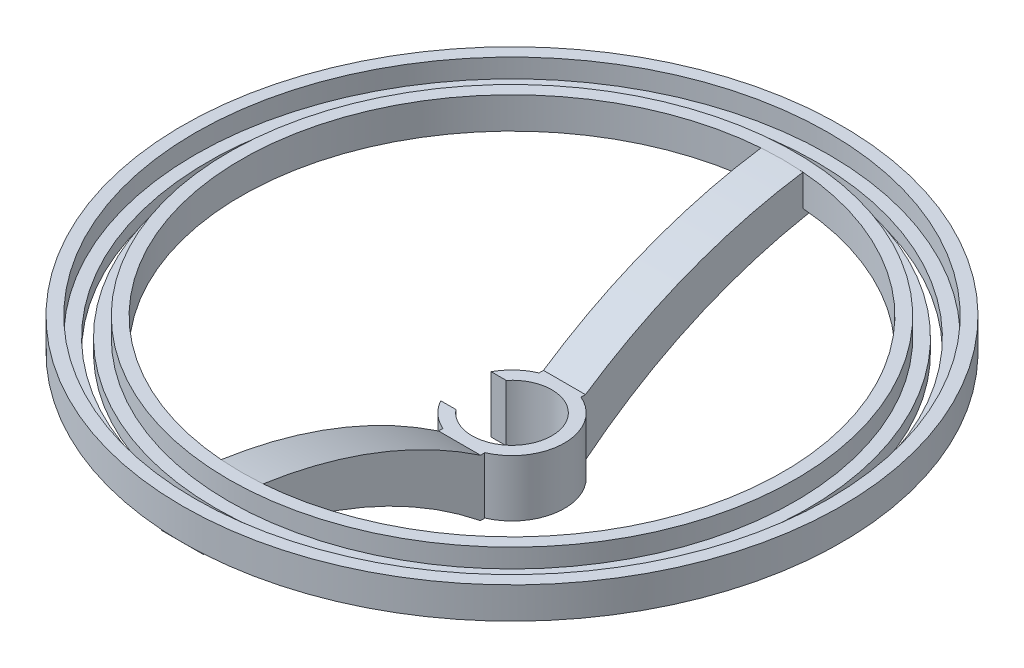
from build123d import *

# Parameters (mm, degrees)
SCHIZZO1_R                   = 12.5
SCHIZZO1_R_2                 = 9.5
ESTRUSIONE_ESTRUSIONE1_DEPTH = 13.5
SCHIZZO2_W                   = 9
SCHIZZO2_H                   = 12
TAGLIO_ESTRUSIONE1_DEPTH     = 23.24297642
ESTRUSIONE_ESTRUSIONE2_DEPTH = 5
SCHIZZO3_R                   = 75.5
SCHIZZO3_R_2                 = 67.5
BOSS_EXTRUDE1_DEPTH          = 3
SKETCH1_W                    = 3
SKETCH1_H                    = 7.5
SKETCH2_R                    = 72.5
SKETCH2_R_2                  = 70.5
CUT_EXTRUDE1_DEPTH           = 3


with BuildPart() as part:
    # Schizzo1 → Estrusione-Estrusione1 (new body)
    with BuildSketch(Plane(origin=(0, 0, 0), x_dir=(1, 0, 0), z_dir=(0, 1, 0))):
        with Locations(Location((0, 0, 0), (0, 0, 270))):
            Circle(SCHIZZO1_R)
        with Locations(Location((0, 0, 0), (0, 0, 270))):
            Circle(SCHIZZO1_R_2, mode=Mode.SUBTRACT)
    extrude(amount=ESTRUSIONE_ESTRUSIONE1_DEPTH)

    # Schizzo2 → Taglio-Estrusione1 (cut, through all)
    with BuildSketch(Plane(origin=(0, 13.5, 0), x_dir=(1, 0, 0), z_dir=(0, 1, 0))):
        with Locations((-11.865459931, 0)):
            Rectangle(SCHIZZO2_W, SCHIZZO2_H)
    extrude(amount=-TAGLIO_ESTRUSIONE1_DEPTH, mode=Mode.SUBTRACT)

    # Schizzo5 → Estrusione-Estrusione2 (add, symmetric)
    with BuildSketch(Plane(origin=(0, 0, 0), x_dir=(0, 0, -1), z_dir=(1, 0, 0))):
        with BuildLine():
            Line((-64.5, 26), (-64.5, 33.5))
            ThreePointArc((-64.5, 33.5), (-37.371539554, 26.433997159), (-12.5, 13.5))
            Line((-12.5, 13.5), (-11.5, 13.5))
            Line((-11.5, 13.5), (-11.5, 0))
            Line((-11.5, 0), (-12.5, 0))
            ThreePointArc((-12.5, 0), (-43.534901683, 17.988326497), (-78.5, 26))
            Line((-78.5, 26), (-64.5, 26))
        make_face()
    estrusione_estrusione2 = extrude(amount=ESTRUSIONE_ESTRUSIONE2_DEPTH, both=True)

    # Schizzo3 → Boss-Extrude1 (add)
    with BuildSketch(Plane(origin=(0, 26, 0), x_dir=(1, 0, 0), z_dir=(0, 1, 0))):
        with Locations(Location((0, 0, 0), (0, 0, 266.202798448))):
            Circle(SCHIZZO3_R)
        with Locations(Location((0, 0, 0), (0, 0, 265.751977333))):
            Circle(SCHIZZO3_R_2, mode=Mode.SUBTRACT)
    extrude(amount=BOSS_EXTRUDE1_DEPTH)

    # Sketch1 → Revolve1 (revolve)
    with BuildSketch(Plane(origin=(0, 0, 0), x_dir=(0, 0, -1), z_dir=(1, 0, 0)), mode=Mode.PRIVATE) as revolve1_sk:
        with Locations((77, 29.75)):
            Rectangle(SKETCH1_W, SKETCH1_H)
        with Locations((66, 29.75)):
            Rectangle(SKETCH1_W, SKETCH1_H)
    revolve(revolve1_sk.sketch.rotate(Axis((0, 39.375, 0), (0, -1, 0)), 180), axis=Axis((0, 39.375, 0), (0, -1, 0)))

    # Mirror1: Estrusione-Estrusione2 across plane
    add(estrusione_estrusione2.mirror(Plane.XY))

    # Sketch2 → Cut-Extrude1 (cut)
    with BuildSketch(Plane(origin=(0, 29, 0), x_dir=(1, 0, 0), z_dir=(0, 1, 0))):
        with Locations(Location((0, 0, 0), (0, 0, 270))):
            Circle(SKETCH2_R)
        with Locations(Location((0, 0, 0), (0, 0, 270))):
            Circle(SKETCH2_R_2, mode=Mode.SUBTRACT)
    extrude(amount=-CUT_EXTRUDE1_DEPTH, mode=Mode.SUBTRACT)


solid = part.part
